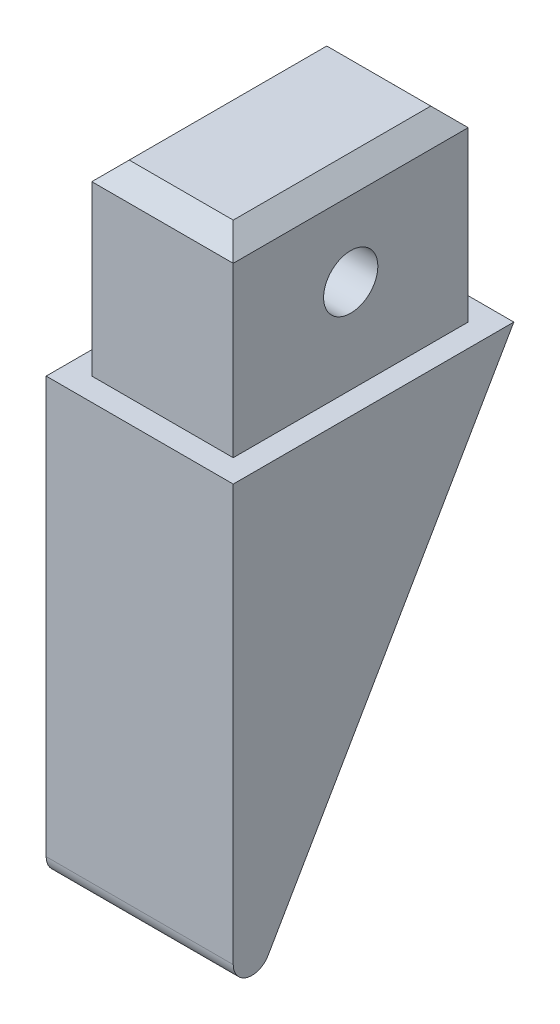
from build123d import *

# Parameters (mm, degrees)
SKETCH_1_W          = 7.56
SKETCH_1_H          = 12.56
EXTRUDE_1_DEPTH     = 10
CHAMFER_1_SIZE      = 1
EXTRUDE_2_DEPTH     = 5
SKETCH_4_R          = 1.45
CUT_EXTRUDE_1_DEPTH = 10
FILLET_1_R          = 1


with BuildPart() as part:
    # ｽｹｯﾁ1 → ﾎﾞｽ - 押し出し1 (new body)
    with BuildSketch(Plane(origin=(0, 0, 0), x_dir=(1, 0, 0), z_dir=(0, 1, 0))):
        Rectangle(SKETCH_1_W, SKETCH_1_H)
    extrude(amount=EXTRUDE_1_DEPTH)

    # 面取り1
    chamfer_1_edges = [part.edges().sort_by_distance(p)[0] for p in [
        (3.78, 10, 0),
        (0, 10, -6.28),
        (-3.78, 10, 0),
        (0, 10, 6.28),
    ]]
    chamfer(chamfer_1_edges, length=CHAMFER_1_SIZE)

    # ｽｹｯﾁ3 → ﾎﾞｽ - 押し出し2 (add, symmetric)
    with BuildSketch(Plane(origin=(0, 0, 0), x_dir=(0, 0, -1), z_dir=(1, 0, 0))):
        Polygon((0, 0), (-6.28, 0), (-7.5, 0), (-7.5, -25.980762114), (7.5, 0), (6.28, 0), align=None)
    extrude(amount=EXTRUDE_2_DEPTH, both=True)

    # ｽｹｯﾁ4 → ｶｯﾄ - 押し出し1 (cut)
    with BuildSketch(Plane(origin=(3.78, 0, 0), x_dir=(0, 0, -1), z_dir=(1, 0, 0))):
        with Locations((0, 5)):
            Circle(SKETCH_4_R)
    extrude(amount=-CUT_EXTRUDE_1_DEPTH, mode=Mode.SUBTRACT)

    # ﾌｨﾚｯﾄ1
    fillet_1_edges = [part.edges().sort_by_distance(p)[0] for p in [
        (0, -25.980762114, 7.5),
    ]]
    fillet(fillet_1_edges, radius=FILLET_1_R)


solid = part.part
